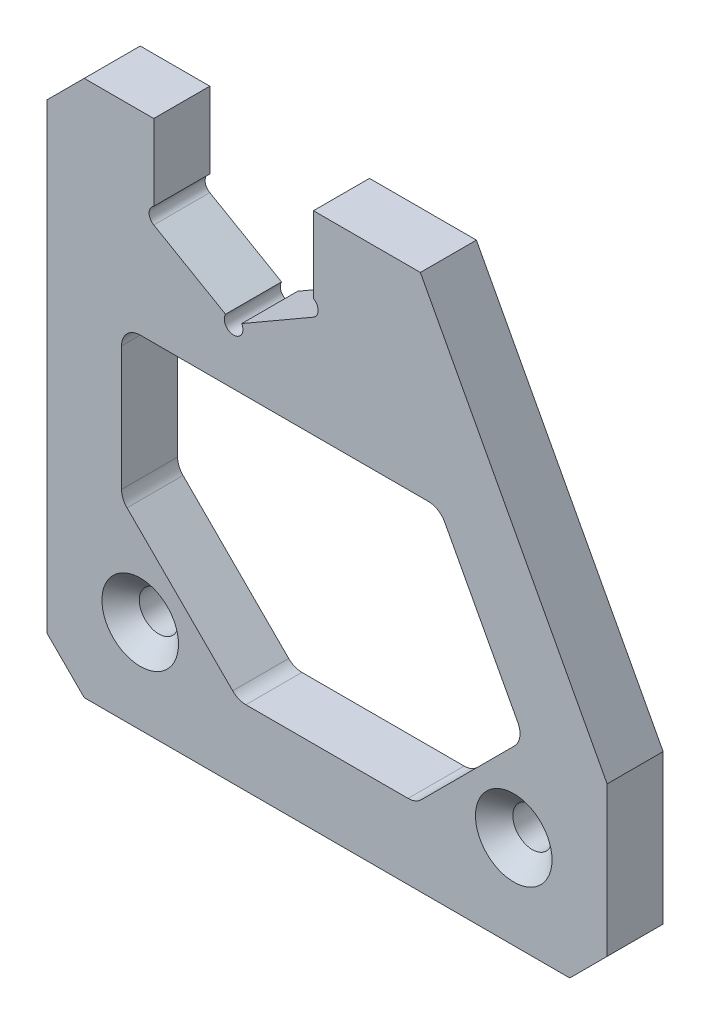
from build123d import *

# Parameters (mm, degrees)
SKETCH_1_R          = 2.1
EXTRUDE_1_DEPTH     = 3
CHAMFER_1_SIZE      = 4
SKETCH_2_R          = 1
CUT_EXTRUDE_1_DEPTH = 67.274052238
CUT_EXTRUDE_2_DEPTH = 67.274052238
FILLET_1_R          = 2
CHAMFER_2_SIZE      = 2


with BuildPart() as part:
    # 草图1 → 凸台-拉伸1 (new, symmetric)
    with BuildSketch(Plane.XY):
        Polygon((-20, 4.936344802), (-20, -52.5), (40, -52.5), (40, -32.5), (20, 4.936344802), (8.55, 4.936344802), (8.55, -4.936344802), (0, -9.872689603), (-8.55, -4.936344802), (-8.55, 4.936344802), align=None)
        with Locations((-10, -42.5)):
            Circle(SKETCH_1_R, mode=Mode.SUBTRACT)
        with Locations((30, -42.5)):
            Circle(SKETCH_1_R, mode=Mode.SUBTRACT)
    extrude(amount=EXTRUDE_1_DEPTH, both=True)

    # 倒角1
    chamfer_1_edges = [part.edges().sort_by_distance(p)[0] for p in [
        (40, -52.5, 0),
        (-20, -52.5, 0),
        (-20, 4.936344802, 0),
    ]]
    chamfer(chamfer_1_edges, length=CHAMFER_1_SIZE)

    # 草图2 → 切除-拉伸1 (cut, through all)
    with BuildSketch(Plane.XY.offset(3)):
        with Locations((-8.05, -4.070319398)):
            Circle(SKETCH_2_R)
        with Locations((8.05, -4.070319398)):
            Circle(SKETCH_2_R)
        with Locations((0, -9.872689603)):
            Circle(SKETCH_2_R)
    extrude(amount=-CUT_EXTRUDE_1_DEPTH, mode=Mode.SUBTRACT)

    # 草图3 → 切除-拉伸2 (cut, through all)
    with BuildSketch(Plane.XY.offset(3)):
        Polygon((-12, -15.872689603), (-12, -32.014718626), (0.485281374, -44.5), (19.514718626, -44.5), (31.133551708, -32.881166917), (22.046939538, -15.872689603), align=None)
    extrude(amount=-CUT_EXTRUDE_2_DEPTH, mode=Mode.SUBTRACT)

    # 圆角1
    fillet_1_edges = [part.edges().sort_by_distance(p)[0] for p in [
        (-12, -15.872689603, 0),
        (22.046939538, -15.872689603, 0),
        (31.133551708, -32.881166917, 0),
        (19.514718626, -44.5, 0),
        (0.485281374, -44.5, 0),
        (-12, -32.014718626, 0),
    ]]
    fillet(fillet_1_edges, radius=FILLET_1_R)

    # 倒角2
    chamfer_2_edges = [part.edges().sort_by_distance(p)[0] for p in [
        (-12.1, -42.5, 3),
        (27.9, -42.5, 3),
    ]]
    chamfer(chamfer_2_edges, length=CHAMFER_2_SIZE)


solid = part.part
